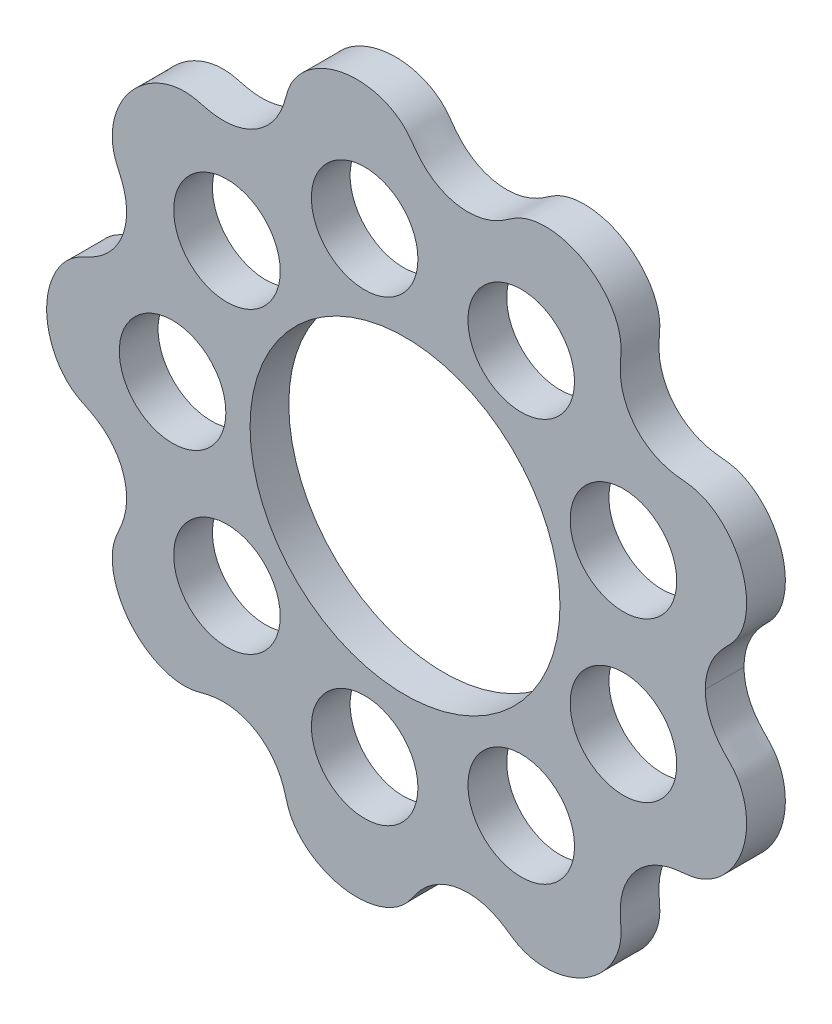
from build123d import *

# Parameters (mm, degrees)
BOSS_EXTRUDE3_DEPTH = 25.4
SKETCH8_R           = 101.6
CUT_EXTRUDE2_DEPTH  = 332.298668666
SKETCH9_R           = 34.925
CUT_EXTRUDE3_DEPTH  = 332.298668666


with BuildPart() as part:
    # Sketch7 → Boss-Extrude3 (new body)
    with BuildSketch(Plane.XY):
        with BuildLine():
            add(Edge.make_bspline(
                [(196.850000119, 0), (196.850000363, -0.311114627), (196.867538454, -2.025054272), (197.075114388, -5.139128932), (197.83736354, -9.605897448), (199.532666634, -14.967637604), (201.82619629, -19.826015579), (204.560837454, -24.15272758), (207.225182164, -27.515280755), (209.558692921, -30.072200821), (211.571662726, -32.136915762), (213.185888344, -33.784896858), (214.831105212, -35.574446358), (216.434835257, -37.564080608), (217.945622029, -39.776867411), (219.331530645, -42.212368442), (220.575121064, -44.849672987), (221.655889075, -47.680158352), (222.786753084, -51.473451974), (223.670377152, -56.052556605), (224.097977881, -61.288574106), (223.881389601, -67.122062527), (223.068217423, -72.67134034), (221.677043858, -78.087843381), (219.734778717, -83.314844536), (217.26718267, -88.297628984), (214.299582497, -92.981454419), (210.737935937, -97.456177123), (206.555566055, -101.611427296), (202.423529457, -104.777474814), (198.546317847, -107.075237433), (195.248972908, -108.605063504), (192.65618279, -109.577360148), (190.108226015, -110.305197723), (187.628813656, -110.807128651), (185.241518923, -111.128770722), (182.964376278, -111.355326465), (180.117828375, -111.636555837), (176.712513148, -112.077531093), (172.543736607, -112.90778816), (167.704548923, -114.411283434), (162.856490008, -116.588571863), (158.132617699, -119.518265509), (153.788196816, -123.108546065), (149.930833646, -127.32391135), (146.666508387, -132.10267119), (144.087699875, -137.36391023), (142.364091391, -142.671859805), (141.500412469, -147.297281836), (141.163780038, -151.112848861), (141.095226002, -154.072736954), (141.1438371, -156.440555259), (141.277168253, -158.80480363), (141.460417781, -161.165344413), (141.6432069, -163.662888824), (141.714423839, -166.304467592), (141.568772261, -169.081536961), (141.163027101, -171.970277428), (140.508491839, -174.869098501), (139.61114974, -177.759532497), (138.188580725, -181.353846696), (136.086882327, -185.445821292), (133.172402557, -189.847864686), (129.307944466, -194.375884416), (125.035222218, -198.360870677), (120.395558618, -201.814473086), (115.462084852, -204.719222362), (110.30179787, -207.06042512), (104.97784471, -208.824799968), (99.270436178, -210.050980587), (93.22727347, -210.614731102), (87.858909934, -210.404283771), (83.254900052, -209.649852353), (79.655881363, -208.668759085), (77.016725151, -207.726674433), (74.57518878, -206.622913578), (72.337322002, -205.388886488), (70.289269191, -204.079291399), (68.385990242, -202.775704941), (66.00300911, -201.151842952), (63.079587044, -199.297843843), (59.305266054, -197.257999499), (54.569187075, -195.316438594), (49.386127287, -193.901678703), (43.811256927, -193.163538073), (38.13385286, -193.195231789), (32.462735816, -194.026494299), (26.918553348, -195.665050295), (21.619754288, -198.095765149), (16.947892733, -201.096237293), (13.365065947, -204.109102664), (10.695371007, -206.828422307), (8.76943242, -209.057077105), (7.305573275, -210.903324671), (5.904787978, -212.79752599), (4.537645681, -214.715644087), (3.070498171, -216.729859327), (1.413853424, -218.772145599), (-0.996829528, -221.300296056), (-3.833001598, -223.659739219), (-6.948397364, -225.731991359), (-10.985580958, -227.877069551), (-15.215761588, -229.624286031), (-20.260384973, -231.08769977), (-26.106198769, -232.040165198), (-31.912629575, -232.322032596), (-37.68177258, -231.966418252), (-43.346420269, -230.997661043), (-48.843672197, -229.438724058), (-54.112187501, -227.311850533), (-59.251050355, -224.546535421), (-63.510501179, -221.556131395), (-66.945053654, -218.545098906), (-69.586137955, -215.738976519), (-71.47046505, -213.416250571), (-73.130625695, -211.020834236), (-74.561195604, -208.569479021), (-75.729618842, -206.121920842), (-76.652465677, -203.707327568), (-77.379708336, -201.360445626), (-78.00369164, -199.115892608), (-78.796819096, -196.313780853), (-79.866767177, -192.985426129), (-81.485492384, -188.961950621), (-83.925749516, -184.395563044), (-87.064566388, -179.954142246), (-90.955764128, -175.794048353), (-95.404960783, -172.198664281), (-100.33522414, -169.251091137), (-105.649382414, -167.021560315), (-111.242229474, -165.558780164), (-116.717544464, -164.918593966), (-121.369403343, -164.968098939), (-125.14093749, -165.365294369), (-128.03760866, -165.854627015), (-130.336659526, -166.340869275), (-132.618958192, -166.899248608), (-134.892767878, -167.489799005), (-137.304331326, -168.074719426), (-139.876316919, -168.546715847), (-142.610254417, -168.823577155), (-145.489157175, -168.869013212), (-148.427508334, -168.679321625), (-151.407112279, -168.254161304), (-155.177496356, -167.42501027), (-159.539340977, -166.012134548), (-164.322190798, -163.86306802), (-169.372260375, -160.819455749), (-173.946269147, -157.311142431), (-178.089118122, -153.346945373), (-181.76539968, -148.986477815), (-184.941877206, -144.286008066), (-187.585889066, -139.300381483), (-189.75087436, -133.853598126), (-191.099586278, -128.761871074), (-191.79291341, -124.146156887), (-191.988626954, -120.193395377), (-191.909108073, -117.158796443), (-191.608146732, -114.247321673), (-191.100735457, -111.474678703), (-190.393948493, -108.858617674), (-189.517074694, -106.411113027), (-188.534818082, -104.124084161), (-187.54605788, -101.960194445), (-186.33834154, -99.2422141), (-185.240453686, -96.476658065), (-184.311641851, -93.648186882), (-183.373720924, -89.976059456), (-182.684028127, -86.021942561), (-182.365054284, -81.193434178), (-182.76274425, -75.548708221), (-183.938028251, -69.998457606), (-185.879326343, -64.652223797), (-188.552495841, -59.620497317), (-191.905040594, -55.001871971), (-195.677580828, -51.074548566), (-199.705284124, -47.81575015), (-203.354856912, -45.473526895), (-206.425002308, -43.809667084), (-209.036267519, -42.528380244), (-211.137215696, -41.528558256), (-213.334584766, -40.432774026), (-215.577987269, -39.147857767), (-217.818693695, -37.615442824), (-220.022076413, -35.819674404), (-222.151100358, -33.784090268), (-224.184794178, -31.512428392), (-226.102510297, -29.010349317), (-227.883482331, -26.285186794), (-229.760063254, -22.908897669), (-231.590071756, -18.827253733), (-233.204194631, -14.006235757), (-234.402853006, -8.45825377), (-234.850965071, -4.229221239), (-234.949999876, -1.404568794), (-234.950000031, 0)],
                knots=[0.121993522, 0.121993522, 0.121993522, 0.121993522, 0.121993522, 0.123195988, 0.128617942, 0.134039895, 0.139451657, 0.144863419, 0.149321467, 0.153779515, 0.156008539, 0.158237563, 0.160466587, 0.162695611, 0.165400438, 0.168105265, 0.170810092, 0.173514919, 0.176659672, 0.179804426, 0.186093933, 0.19150286, 0.196911788, 0.202320716, 0.207729644, 0.213077272, 0.218424901, 0.22377253, 0.229120159, 0.235137686, 0.241155214, 0.243828177, 0.24650114, 0.249174102, 0.251847065, 0.254058203, 0.25626934, 0.258480478, 0.260691615, 0.26511389, 0.269536165, 0.27488581, 0.280235454, 0.285595589, 0.290955723, 0.296601472, 0.30224722, 0.307886113, 0.313525006, 0.318100538, 0.320388304, 0.322676069, 0.324963835, 0.327251601, 0.329539367, 0.331827133, 0.334642449, 0.337457766, 0.340273082, 0.343088399, 0.346116131, 0.349143864, 0.355199329, 0.36083298, 0.366466631, 0.372100282, 0.377733933, 0.383143002, 0.388552071, 0.393961139, 0.399370208, 0.405659874, 0.41194954, 0.41465444, 0.417359339, 0.420064239, 0.422769138, 0.424998218, 0.427227297, 0.429456377, 0.431685457, 0.436143616, 0.440601775, 0.446013687, 0.4514256, 0.456847692, 0.462269784, 0.467887673, 0.473505562, 0.479115895, 0.484726228, 0.489278419, 0.491554515, 0.49383061, 0.496106705, 0.498382801, 0.500658896, 0.502934991, 0.505736853, 0.508538714, 0.514142437, 0.517154817, 0.520167198, 0.526191958, 0.531797464, 0.53740297, 0.543008477, 0.548613983, 0.554093099, 0.559572216, 0.565051332, 0.570530449, 0.576600818, 0.579636003, 0.582671187, 0.585410726, 0.588150265, 0.590889803, 0.593629342, 0.59588045, 0.598131559, 0.600382667, 0.602633775, 0.607135992, 0.611638209, 0.617118981, 0.622599752, 0.62809222, 0.633584688, 0.639156061, 0.644727433, 0.6502911, 0.655854766, 0.660394956, 0.662665051, 0.664935146, 0.667205241, 0.669475336, 0.671745431, 0.674015526, 0.676794493, 0.679573461, 0.682352429, 0.685131396, 0.688163352, 0.691195308, 0.69725922, 0.70281792, 0.70837662, 0.713935321, 0.719494021, 0.724936348, 0.730378675, 0.735821002, 0.741263329, 0.747543527, 0.750683626, 0.753823725, 0.756544378, 0.75926503, 0.761985682, 0.764706335, 0.767005268, 0.769304201, 0.771603135, 0.773902068, 0.778499935, 0.780798868, 0.783097801, 0.788544263, 0.793990725, 0.799445359, 0.804899992, 0.810401246, 0.815902501, 0.821395074, 0.826887647, 0.831384229, 0.835880811, 0.838129102, 0.840377393, 0.842625684, 0.844873976, 0.847617504, 0.850361032, 0.85310456, 0.855848088, 0.858990975, 0.862133862, 0.865276748, 0.868419635, 0.873908236, 0.879396838, 0.884885439, 0.890314081, 0.890314081, 0.890314081, 0.890314081, 0.890314081], degree=4))
            add(Edge.make_bspline(
                [(196.850000119, 0), (196.850000365, 0.311114545), (196.867538465, 2.025054107), (197.075114402, 5.139128684), (197.83736354, 9.605897119), (199.532666634, 14.967637275), (201.82619629, 19.826015251), (204.560837454, 24.152727251), (207.225182164, 27.515280426), (209.558692921, 30.072200492), (211.571662726, 32.136915433), (213.185888344, 33.784896529), (214.831105212, 35.574446029), (216.434835257, 37.564080279), (217.945622029, 39.776867082), (219.331530645, 42.212368113), (220.575121064, 44.849672658), (221.655889075, 47.680158023), (222.786753084, 51.473451645), (223.670377152, 56.052556276), (224.097977881, 61.288573777), (223.881389601, 67.122062198), (223.068217423, 72.671340011), (221.677043858, 78.087843052), (219.734778717, 83.314844207), (217.26718267, 88.297628655), (214.299582497, 92.98145409), (210.737935937, 97.456176794), (206.555566055, 101.611426967), (202.423529457, 104.777474485), (198.546317847, 107.075237104), (195.248972908, 108.605063175), (192.65618279, 109.577359819), (190.108226015, 110.305197394), (187.628813656, 110.807128322), (185.241518923, 111.128770393), (182.964376278, 111.355326136), (180.117828375, 111.636555508), (176.712513148, 112.077530764), (172.543736607, 112.907787831), (167.704548923, 114.411283105), (162.856490008, 116.588571534), (158.132617699, 119.51826518), (153.788196816, 123.108545737), (149.930833646, 127.323911021), (146.666508387, 132.102670861), (144.087699875, 137.363909901), (142.364091391, 142.671859477), (141.500412469, 147.297281507), (141.163780038, 151.112848532), (141.095226002, 154.072736625), (141.1438371, 156.44055493), (141.277168253, 158.804803301), (141.460417781, 161.165344084), (141.6432069, 163.662888495), (141.714423839, 166.304467263), (141.568772261, 169.081536632), (141.163027101, 171.970277099), (140.508491839, 174.869098172), (139.61114974, 177.759532168), (138.188580725, 181.353846367), (136.086882327, 185.445820963), (133.172402557, 189.847864357), (129.307944466, 194.375884087), (125.035222218, 198.360870348), (120.395558618, 201.814472757), (115.462084852, 204.719222033), (110.30179787, 207.060424791), (104.97784471, 208.824799639), (99.270436178, 210.050980258), (93.22727347, 210.614730773), (87.858909934, 210.404283442), (83.254900052, 209.649852024), (79.655881363, 208.668758756), (77.016725151, 207.726674104), (74.57518878, 206.622913249), (72.337322002, 205.388886159), (70.289269191, 204.07929107), (68.385990242, 202.775704612), (66.00300911, 201.151842623), (63.079587044, 199.297843514), (59.305266054, 197.25799917), (54.569187075, 195.316438265), (49.386127287, 193.901678374), (43.811256927, 193.163537744), (38.13385286, 193.195231461), (32.462735816, 194.02649397), (26.918553348, 195.665049966), (21.619754288, 198.09576482), (16.947892733, 201.096236964), (13.365065947, 204.109102335), (10.695371007, 206.828421978), (8.76943242, 209.057076776), (7.305573275, 210.903324342), (5.904787978, 212.797525661), (4.537645681, 214.715643758), (3.070498171, 216.729858998), (1.413853424, 218.77214527), (-0.996829528, 221.300295727), (-3.833001598, 223.65973889), (-6.948397364, 225.73199103), (-10.985580958, 227.877069222), (-15.215761588, 229.624285702), (-20.260384973, 231.087699441), (-26.106198769, 232.040164869), (-31.912629575, 232.322032267), (-37.68177258, 231.966417923), (-43.346420269, 230.997660714), (-48.843672197, 229.438723729), (-54.112187501, 227.311850204), (-59.251050355, 224.546535092), (-63.510501179, 221.556131066), (-66.945053654, 218.545098577), (-69.586137955, 215.73897619), (-71.47046505, 213.416250242), (-73.130625695, 211.020833907), (-74.561195604, 208.569478692), (-75.729618842, 206.121920513), (-76.652465677, 203.707327239), (-77.379708336, 201.360445297), (-78.00369164, 199.115892279), (-78.796819096, 196.313780524), (-79.866767177, 192.9854258), (-81.485492384, 188.961950292), (-83.925749516, 184.395562715), (-87.064566388, 179.954141917), (-90.955764128, 175.794048024), (-95.404960783, 172.198663952), (-100.33522414, 169.251090808), (-105.649382414, 167.021559986), (-111.242229474, 165.558779835), (-116.717544464, 164.918593637), (-121.369403343, 164.96809861), (-125.14093749, 165.36529404), (-128.03760866, 165.854626686), (-130.336659526, 166.340868946), (-132.618958192, 166.899248279), (-134.892767878, 167.489798676), (-137.304331326, 168.074719097), (-139.876316919, 168.546715518), (-142.610254417, 168.823576826), (-145.489157175, 168.869012883), (-148.427508334, 168.679321296), (-151.407112279, 168.254160975), (-155.177496356, 167.425009941), (-159.539340977, 166.012134219), (-164.322190798, 163.863067691), (-169.372260375, 160.81945542), (-173.946269147, 157.311142102), (-178.089118122, 153.346945044), (-181.76539968, 148.986477486), (-184.941877206, 144.286007737), (-187.585889066, 139.300381154), (-189.75087436, 133.853597797), (-191.099586278, 128.761870745), (-191.79291341, 124.146156558), (-191.988626954, 120.193395048), (-191.909108073, 117.158796114), (-191.608146732, 114.247321344), (-191.100735457, 111.474678374), (-190.393948493, 108.858617345), (-189.517074694, 106.411112698), (-188.534818082, 104.124083832), (-187.54605788, 101.960194117), (-186.33834154, 99.242213771), (-185.240453686, 96.476657736), (-184.311641851, 93.648186553), (-183.373720924, 89.976059127), (-182.684028127, 86.021942232), (-182.365054284, 81.193433849), (-182.76274425, 75.548707892), (-183.938028251, 69.998457277), (-185.879326343, 64.652223468), (-188.552495841, 59.620496988), (-191.905040594, 55.001871642), (-195.677580828, 51.074548237), (-199.705284124, 47.815749821), (-203.354856912, 45.473526566), (-206.425002308, 43.809666755), (-209.036267519, 42.528379915), (-211.137215696, 41.528557927), (-213.334584766, 40.432773697), (-215.577987269, 39.147857438), (-217.818693695, 37.615442496), (-220.022076413, 35.819674075), (-222.151100358, 33.784089939), (-224.184794178, 31.512428063), (-226.102510297, 29.010348988), (-227.883482331, 26.285186465), (-229.760063254, 22.90889734), (-231.590071756, 18.827253404), (-233.204194631, 14.006235428), (-234.402852988, 8.458253522), (-234.850965053, 4.229221074), (-234.949999867, 1.404568712), (-234.950000031, 0)],
                knots=[0.121993522, 0.121993522, 0.121993522, 0.121993522, 0.121993522, 0.123195988, 0.128617942, 0.134039895, 0.139451657, 0.144863419, 0.149321467, 0.153779515, 0.156008539, 0.158237563, 0.160466587, 0.162695611, 0.165400438, 0.168105265, 0.170810092, 0.173514919, 0.176659672, 0.179804426, 0.186093933, 0.19150286, 0.196911788, 0.202320716, 0.207729644, 0.213077272, 0.218424901, 0.22377253, 0.229120159, 0.235137686, 0.241155214, 0.243828177, 0.24650114, 0.249174102, 0.251847065, 0.254058203, 0.25626934, 0.258480478, 0.260691615, 0.26511389, 0.269536165, 0.27488581, 0.280235454, 0.285595589, 0.290955723, 0.296601472, 0.30224722, 0.307886113, 0.313525006, 0.318100538, 0.320388304, 0.322676069, 0.324963835, 0.327251601, 0.329539367, 0.331827133, 0.334642449, 0.337457766, 0.340273082, 0.343088399, 0.346116131, 0.349143864, 0.355199329, 0.36083298, 0.366466631, 0.372100282, 0.377733933, 0.383143002, 0.388552071, 0.393961139, 0.399370208, 0.405659874, 0.41194954, 0.41465444, 0.417359339, 0.420064239, 0.422769138, 0.424998218, 0.427227297, 0.429456377, 0.431685457, 0.436143616, 0.440601775, 0.446013687, 0.4514256, 0.456847692, 0.462269784, 0.467887673, 0.473505562, 0.479115895, 0.484726228, 0.489278419, 0.491554515, 0.49383061, 0.496106705, 0.498382801, 0.500658896, 0.502934991, 0.505736853, 0.508538714, 0.514142437, 0.517154817, 0.520167198, 0.526191958, 0.531797464, 0.53740297, 0.543008477, 0.548613983, 0.554093099, 0.559572216, 0.565051332, 0.570530449, 0.576600818, 0.579636003, 0.582671187, 0.585410726, 0.588150265, 0.590889803, 0.593629342, 0.59588045, 0.598131559, 0.600382667, 0.602633775, 0.607135992, 0.611638209, 0.617118981, 0.622599752, 0.62809222, 0.633584688, 0.639156061, 0.644727433, 0.6502911, 0.655854766, 0.660394956, 0.662665051, 0.664935146, 0.667205241, 0.669475336, 0.671745431, 0.674015526, 0.676794493, 0.679573461, 0.682352429, 0.685131396, 0.688163352, 0.691195308, 0.69725922, 0.70281792, 0.70837662, 0.713935321, 0.719494021, 0.724936348, 0.730378675, 0.735821002, 0.741263329, 0.747543527, 0.750683626, 0.753823725, 0.756544378, 0.75926503, 0.761985682, 0.764706335, 0.767005268, 0.769304201, 0.771603135, 0.773902068, 0.778499935, 0.780798868, 0.783097801, 0.788544263, 0.793990725, 0.799445359, 0.804899992, 0.810401246, 0.815902501, 0.821395074, 0.826887647, 0.831384229, 0.835880811, 0.838129102, 0.840377393, 0.842625684, 0.844873976, 0.847617504, 0.850361032, 0.85310456, 0.855848088, 0.858990975, 0.862133862, 0.865276748, 0.868419635, 0.873908236, 0.879396838, 0.884885439, 0.890314081, 0.890314081, 0.890314081, 0.890314081, 0.890314081], degree=4))
        make_face()
    extrude(amount=BOSS_EXTRUDE3_DEPTH)

    # Sketch8 → Cut-Extrude2 (cut, through all)
    with BuildSketch(Plane.XY.offset(25.4)):
        Circle(SKETCH8_R)
    extrude(amount=-CUT_EXTRUDE2_DEPTH, mode=Mode.SUBTRACT)

    # Sketch9 → Cut-Extrude3 (cut, through all)
    with BuildSketch(Plane.XY.offset(25.4)):
        with Locations((-152.4, 0)):
            Circle(SKETCH9_R)
        with Locations((-116.745173131, 97.960831716)):
            Circle(SKETCH9_R)
        with Locations((-26.463982276, 150.084701559)):
            Circle(SKETCH9_R)
        with Locations((76.2, 131.982271537)):
            Circle(SKETCH9_R)
        with Locations((143.209155408, 52.123869843)):
            Circle(SKETCH9_R)
        with Locations((143.209155408, -52.123869843)):
            Circle(SKETCH9_R)
        with Locations((76.2, -131.982271537)):
            Circle(SKETCH9_R)
        with Locations((-26.463982276, -150.084701559)):
            Circle(SKETCH9_R)
        with Locations((-116.745173131, -97.960831716)):
            Circle(SKETCH9_R)
    extrude(amount=-CUT_EXTRUDE3_DEPTH, mode=Mode.SUBTRACT)


solid = part.part
